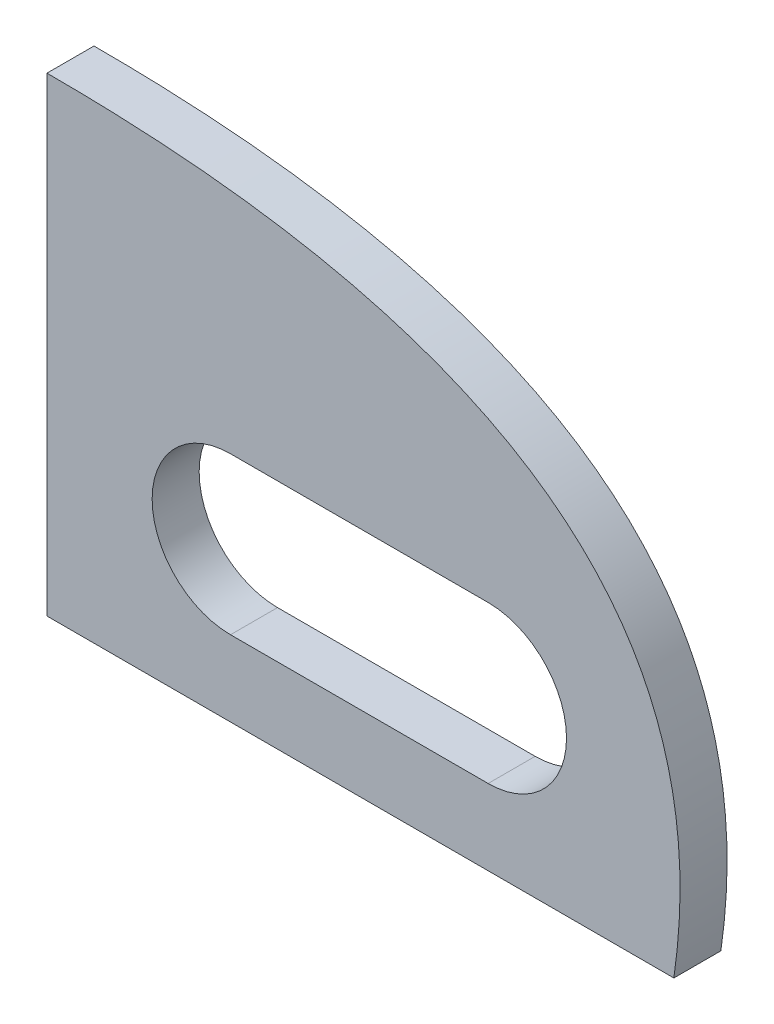
from build123d import *

# Parameters (mm, degrees)
BOSS_EXTRUDE2_DEPTH = 3


with BuildPart() as part:
    # Sketch1 → Boss-Extrude2 (new body)
    with BuildSketch(Plane.XY):
        with BuildLine():
            Line((0, 30), (0, 0))
            Line((0, 0), (40, 0))
            add(Edge.make_bspline(
                [(0, 30), (44.385466319, 30.011757551), (40, 0)],
                knots=[0, 0, 0, 1, 1, 1], degree=2))
        make_face()
        with BuildLine():
            Line((11.710831717, 14.823563468), (28.149637062, 14.823563468))
            ThreePointArc((28.149637062, 14.823563468), (33.149637062, 9.823563468), (28.149637062, 4.823563468))
            Line((28.149637062, 4.823563468), (11.710831717, 4.823563468))
            ThreePointArc((11.710831717, 4.823563468), (6.710831717, 9.823563468), (11.710831717, 14.823563468))
        make_face(mode=Mode.SUBTRACT)
    extrude(amount=BOSS_EXTRUDE2_DEPTH)


solid = part.part
